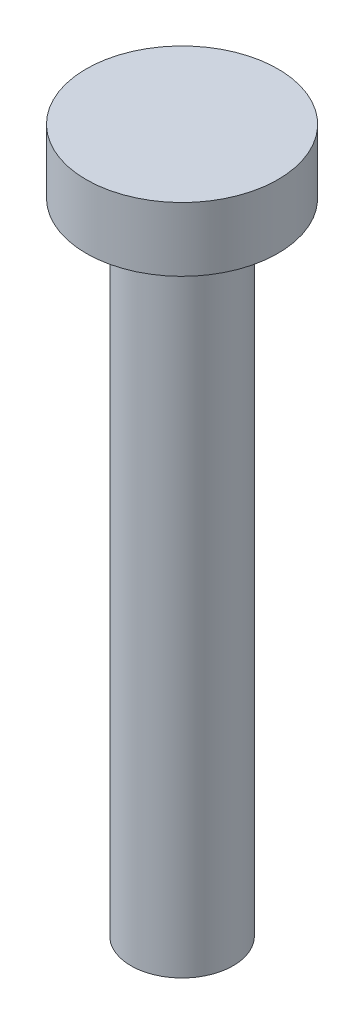
from build123d import *

# Parameters (mm, degrees)
SKETCH_1_R      = 8
EXTRUDE_1_DEPTH = 100
SKETCH_2_R      = 15
EXTRUDE_2_DEPTH = 10


with BuildPart() as part:
    # 草图1 → 凸台-拉伸1 (new body)
    with BuildSketch(Plane(origin=(0, 0, 0), x_dir=(1, 0, 0), z_dir=(0, 1, 0))):
        with Locations(Location((0, 0, 0), (0, 0, 270))):
            Circle(SKETCH_1_R)
    extrude(amount=EXTRUDE_1_DEPTH)

    # 草图2 → 凸台-拉伸2 (add)
    with BuildSketch(Plane(origin=(0, 100, 0), x_dir=(1, 0, 0), z_dir=(0, 1, 0))):
        with Locations(Location((0, 0, 0), (0, 0, 270))):
            Circle(SKETCH_2_R)
    extrude(amount=EXTRUDE_2_DEPTH)


solid = part.part
